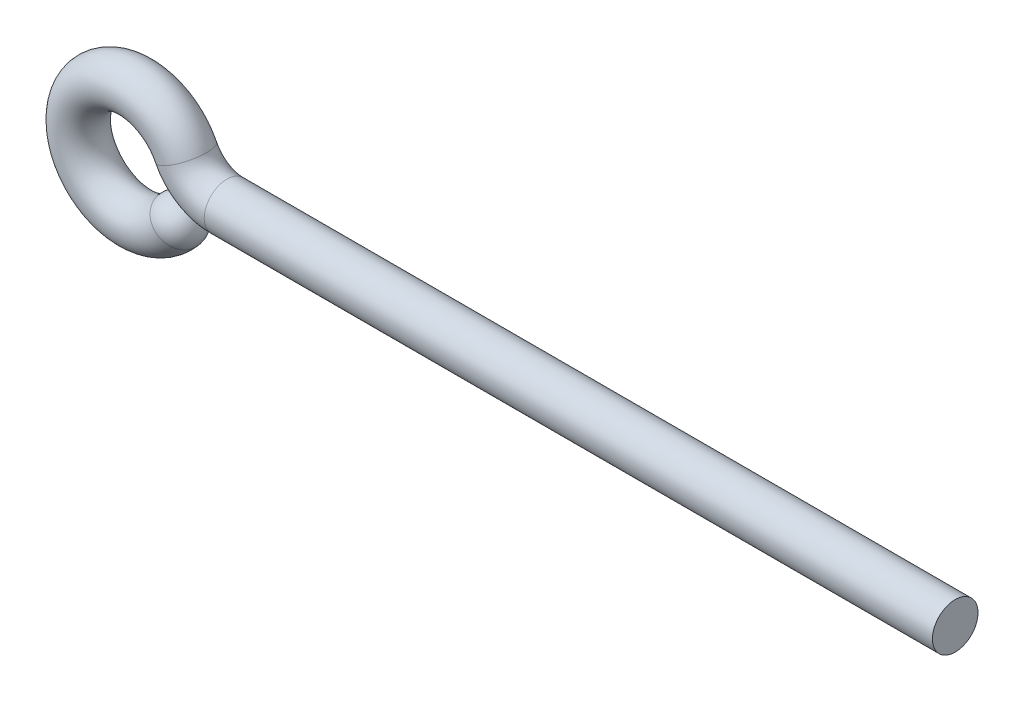
from build123d import *

# Parameters (mm, degrees)
SKETCH2_R           = 1
SKETCH3_R           = 1
BOSS_EXTRUDE1_DEPTH = 30
DOME1_FACE_RADIUS   = 1
DOME1_HEIGHT        = 1


with BuildPart() as part:
    # Sweep1: sweep along a path in Sketch1
    with BuildLine(Plane.XY) as sweep1_path:
        Line((0, 0), (-1.968871126, 0))
        ThreePointArc((-1.968871126, 0), (-3.022963679, 0.300326829), (-3.760483959, 1.111111111))
        ThreePointArc((-3.760483959, 1.111111111), (-8.482382241, 0.29627421), (-4.084888892, -1.606969024))
    # Sketch2 → Sweep1 (sweep)
    with BuildSketch(Plane(origin=(0, 0, 0), x_dir=(0, 0, -1), z_dir=(1, 0, 0))):
        Circle(SKETCH2_R)
    sweep(path=sweep1_path.line)

    # Sketch3 → Boss-Extrude1 (add)
    with BuildSketch(Plane(origin=(0, 0, 0), x_dir=(0, 0, -1), z_dir=(1, 0, 0))):
        with Locations(Location((0, 0, 0), (0, 0, 270))):
            Circle(SKETCH3_R)
    extrude(amount=BOSS_EXTRUDE1_DEPTH)

    # Dome1: a dome of height H over a round flat face of radius A is a cap of a sphere of radius (A * A + H * H) / (2 * H)
    dome1_r = (DOME1_FACE_RADIUS * DOME1_FACE_RADIUS + DOME1_HEIGHT * DOME1_HEIGHT) / (2 * DOME1_HEIGHT)
    dome1_base = Plane((-4.084888892, -1.606969024, 0), z_dir=(0.642787609687, 0.766044443119, 0))
    with Locations(dome1_base.offset(DOME1_HEIGHT - dome1_r)):
        dome1_ball = Sphere(dome1_r, mode=Mode.PRIVATE)
    add(split(dome1_ball, bisect_by=dome1_base, keep=Keep.TOP, mode=Mode.PRIVATE))


solid = part.part
